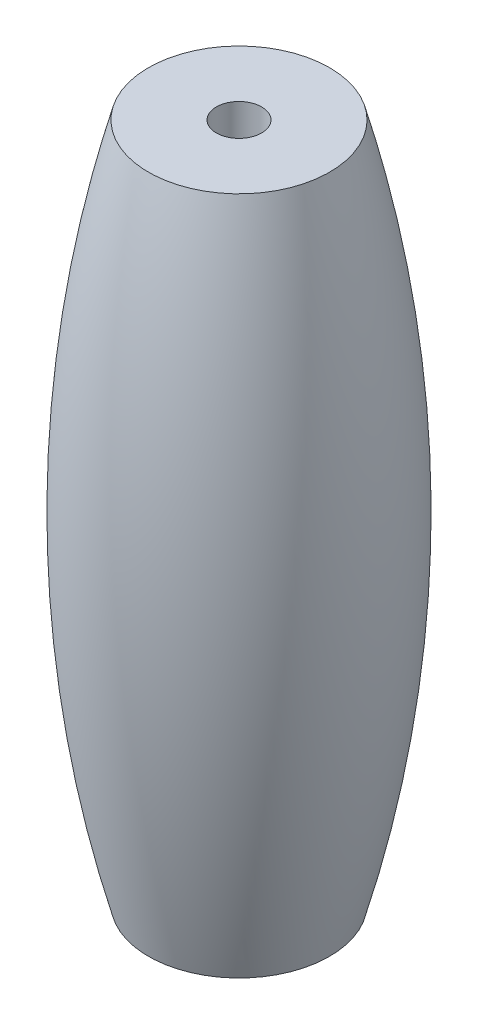
from build123d import *

# Parameters (mm, degrees)
ESQUISSE2_R             = 1
ENL_V_MAT_EXTRU_1_DEPTH = 32.176914671


with BuildPart() as part:
    # Esquisse1 → Révolution1 (revolve)
    with BuildSketch(Plane.XY, mode=Mode.PRIVATE) as r_volution1_sk:
        with BuildLine():
            Line((0, 0), (4, 0))
            ThreePointArc((4, 0), (5.497797314, 7.433627025), (6, 15))
            ThreePointArc((6, 15), (5.497797314, 22.566372975), (4, 30))
            Line((4, 30), (0, 30))
            Line((0, 30), (0, 0))
        make_face()
    revolve(r_volution1_sk.sketch.rotate(Axis((0, 0, 0), (0, 1, 0)), 90), axis=Axis((0, 0, 0), (0, 1, 0)))

    # Esquisse2 → Enlèv. mat.-Extru.1 (cut, through all)
    with BuildSketch(Plane(origin=(0, 30, 0), x_dir=(1, 0, 0), z_dir=(0, 1, 0))):
        with Locations(Location((0, 0, 0), (0, 0, 270))):
            Circle(ESQUISSE2_R)
    extrude(amount=-ENL_V_MAT_EXTRU_1_DEPTH, mode=Mode.SUBTRACT)


solid = part.part
